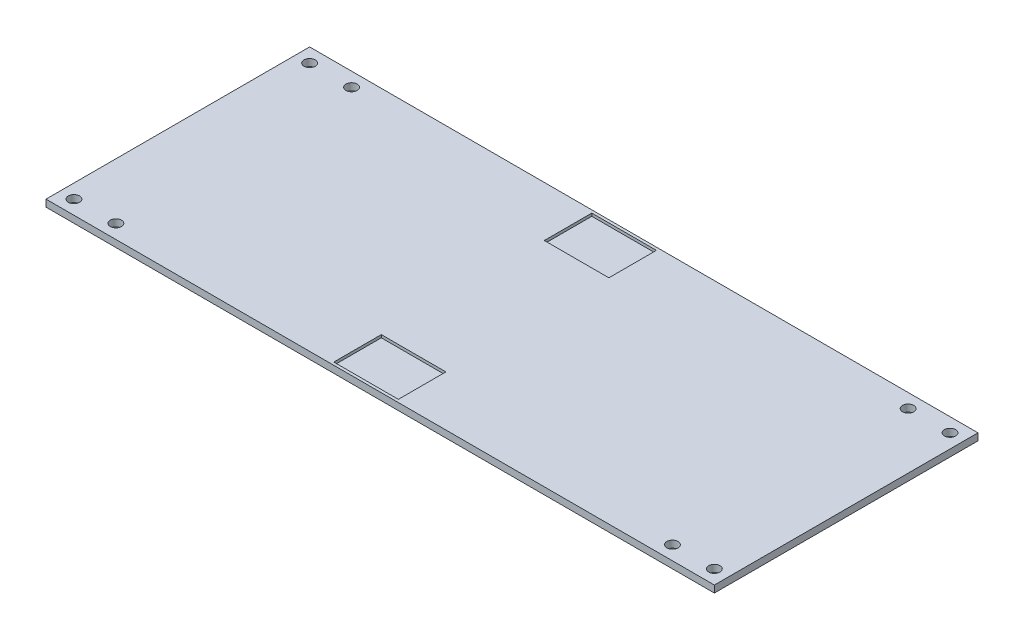
from build123d import *

# Parameters (mm, degrees)
ESQUISSE1_W             = 478.153686012
ESQUISSE1_H             = 188.593708553
ESQUISSE1_R             = 4
BOSS_EXTRU_4_DEPTH      = 5
ESQUISSE2_W             = 35.2
ESQUISSE2_H             = 34
ESQUISSE2_W_2           = 11
ENL_V_MAT_EXTRU_1_DEPTH = 2


with BuildPart() as part:
    # Esquisse1 → Boss.-Extru.4 (new body)
    with BuildSketch(Plane(origin=(0, 0, 0), x_dir=(1, 0, 0), z_dir=(0, 1, 0))):
        with Locations((166.159297522, 47.085285911)):
            Rectangle(ESQUISSE1_W, ESQUISSE1_H)
        with Locations(Location((395.236140528, -37.211568366, 0), (0, 0, 270))):
            Circle(ESQUISSE1_R, mode=Mode.SUBTRACT)
        with Locations(Location((-62.917545484, -37.211568366, 0), (0, 0, 270))):
            Circle(ESQUISSE1_R, mode=Mode.SUBTRACT)
        with Locations(Location((-32.917545484, -37.211568366, 0), (0, 0, 270))):
            Circle(ESQUISSE1_R, mode=Mode.SUBTRACT)
        with Locations(Location((365.236140528, -37.211568366, 0), (0, 0, 270))):
            Circle(ESQUISSE1_R, mode=Mode.SUBTRACT)
        with Locations(Location((-62.917545484, 131.382140187, 0), (0, 0, 270))):
            Circle(ESQUISSE1_R, mode=Mode.SUBTRACT)
        with Locations(Location((-32.917545484, 131.382140187, 0), (0, 0, 270))):
            Circle(ESQUISSE1_R, mode=Mode.SUBTRACT)
        with Locations(Location((365.236140528, 131.382140187, 0), (0, 0, 270))):
            Circle(ESQUISSE1_R, mode=Mode.SUBTRACT)
        with Locations(Location((395.236140528, 131.382140187, 0), (0, 0, 270))):
            Circle(ESQUISSE1_R, mode=Mode.SUBTRACT)
    extrude(amount=BOSS_EXTRU_4_DEPTH)

    # Esquisse2 → Enlèv. mat.-Extru.1 (cut)
    with BuildSketch(Plane(origin=(0, 5, 0), x_dir=(1, 0, 0), z_dir=(0, 1, 0))):
        with Locations((148.559297522, 122.382140187)):
            Rectangle(ESQUISSE2_W, ESQUISSE2_H)
        with Locations((171.659297522, 122.382140187)):
            Rectangle(ESQUISSE2_W_2, ESQUISSE2_H)
        with Locations((148.559297522, -28.211568366)):
            Rectangle(ESQUISSE2_W, ESQUISSE2_H)
        with Locations((171.659297522, -28.211568366)):
            Rectangle(ESQUISSE2_W_2, ESQUISSE2_H)
    extrude(amount=-ENL_V_MAT_EXTRU_1_DEPTH, mode=Mode.SUBTRACT)


solid = part.part
